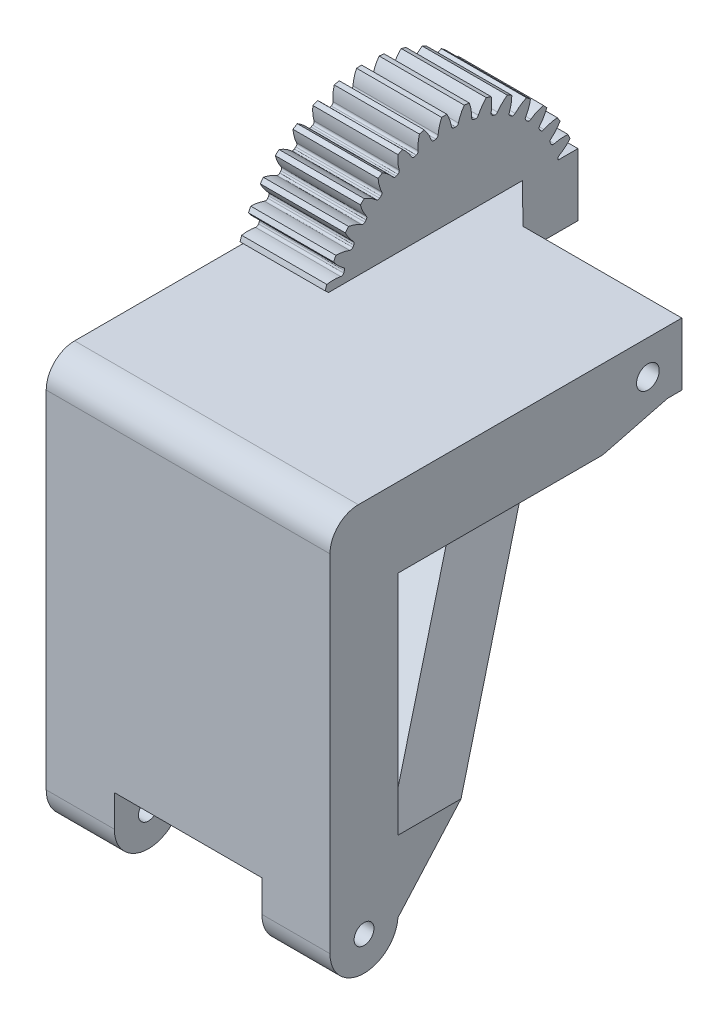
from build123d import *

# Parameters (mm, degrees)
BOSS_EXTRUDE1_START     = 67.5
SKETCH2_R               = 1.749991042
SKETCH2_R_2             = 2.000000542
BOSS_EXTRUDE1_DEPTH     = 50
CUT_EXTRUDE1_DEPTH      = 311.590163462
CUT_EXTRUDE2_START      = 270.018646
CUT_EXTRUDE2_DEPTH      = 53
FILLET1_R               = 5
CUT_EXTRUDE3_DEPTH      = 314.871213788
BOSS_EXTRUDE2_DEPTH     = 15
FILLET1_OF_MIRROR2_R    = 5
CUT_EXTRUDE4_DEPTH      = 145.189488516
CUT_EXTRUDE4_DEPTH_BACK = 145.189488516


with BuildPart() as part:
    # Sketch2 → Boss-Extrude1 (new body)
    with BuildSketch(Plane(origin=(0, 0, 0), x_dir=(0, 0, -1), z_dir=(1, 0, 0)).offset(BOSS_EXTRUDE1_START)):
        with BuildLine():
            Line((-282, -50), (-282, 16.00617549))
            Line((-282, 16.00617549), (-203.32772184, 16.00617549))
            Line((-203.32772184, 16.00617549), (-203.32772184, 4.993638415))
            Line((-203.32772184, 4.993638415), (-222.546576225, 4.993638415))
            Line((-222.546576225, 4.993638415), (-233.933118877, 2.071428354))
            Line((-233.933118877, 2.071428354), (-233.933118877, -9.676461133))
            Line((-233.933118877, -9.676461133), (-270.01864624, -50.472583771))
            ThreePointArc((-270.01864624, -50.472583771), (-276.236478609, -55.995334907), (-282, -50))
        make_face()
        with Locations((-276.000004168, -49.999991628)):
            Circle(SKETCH2_R, mode=Mode.SUBTRACT)
        with Locations((-226.000007629, 10.00000276)):
            Circle(SKETCH2_R_2, mode=Mode.SUBTRACT)
        Polygon((-270.01864624, 2.071428354), (-270.01864624, -35.815644584), (-240.365280151, -2.407390833), (-240.373748779, 1.861065388), align=None, mode=Mode.SUBTRACT)
    boss_extrude1 = extrude(amount=BOSS_EXTRUDE1_DEPTH)

    # Sketch3 → Cut-Extrude1 (cut, through all)
    with BuildSketch(Plane.XY):
        Polygon((79.5, -55.891571045), (79.5, -57.717029151), (105.5, -57.717029151), (105.5, -55.891571045), (105.5, -44.409832001), (79.5, -44.409832001), align=None)
    cut_extrude1 = extrude(amount=CUT_EXTRUDE1_DEPTH, mode=Mode.SUBTRACT)

    # Sketch4 → Cut-Extrude2 (cut)
    with BuildSketch(Plane.XY.offset(CUT_EXTRUDE2_START)):
        with BuildLine():
            Line((105.5, -44.409832001), (94.396057101, -22.201946203))
            ThreePointArc((94.396057101, -22.201946203), (92.5, -21.03011847), (90.603942899, -22.201946203))
            Line((90.603942899, -22.201946203), (79.5, -44.409832001))
            Line((79.5, -44.409832001), (105.5, -44.409832001))
        make_face()
        Polygon((97.5, 2.071428354), (117.5, -37.928571646), (117.5, 2.071428354), align=None)
        Polygon((87.5, 2.071428354), (67.5, 2.071428354), (67.5, -37.928571646), align=None)
    cut_extrude2 = extrude(amount=-CUT_EXTRUDE2_DEPTH, mode=Mode.SUBTRACT)

    # Fillet1
    fillet1_edges = [part.edges().sort_by_distance(p)[0] for p in [
        (92.5, 16.00617549, 282),
    ]]
    fillet(fillet1_edges, radius=FILLET1_R)

    # Sketch5 → Cut-Extrude3 (cut, through all)
    with BuildSketch(Plane(origin=(0, 16.00617549, 0), x_dir=(1, 0, 0), z_dir=(0, 1, 0))):
        Polygon((65.025072437, -220.027445568), (95.5, -220.031402588), (102.5, -213.068008423), (102.5, -196.177042143), (65.025072437, -196.177042143), align=None)
    cut_extrude3 = extrude(amount=-CUT_EXTRUDE3_DEPTH, mode=Mode.SUBTRACT)

    # Sketch7 → Boss-Extrude2 (add)
    with BuildSketch(Plane(origin=(117.5, 0, 0), x_dir=(0, 0, -1), z_dir=(1, 0, 0))):
        with BuildLine():
            Line((-247.249302419, 16.00617549), (-206.818352614, 16.00617549))
            ThreePointArc((-206.818352614, 16.00617549), (-206.832576029, 16.051412996), (-206.846906131, 16.096616819))
            add(Edge.make_bspline(
                [(-206.59811571, 16.641008158), (-206.936572327, 16.462467229), (-206.846906131, 16.096616819)],
                knots=[0, 0, 0, 1, 1, 1], degree=2))
            add(Edge.make_bspline(
                [(-204.7237122, 18.195077672), (-205.525462421, 17.256671604), (-206.59811571, 16.641008158)],
                knots=[0, 0, 0, 1, 1, 1], degree=2))
            ThreePointArc((-204.7237122, 18.195077672), (-204.805887516, 18.405314927), (-204.890140189, 18.61472833))
            ThreePointArc((-204.890140189, 18.61472833), (-204.97646196, 18.823297354), (-205.064844369, 19.031001557))
            add(Edge.make_bspline(
                [(-205.064844369, 19.031001557), (-206.294240862, 19.140516985), (-207.49138078, 18.829900546)],
                knots=[0, 0, 0, 1, 1, 1], degree=2))
            add(Edge.make_bspline(
                [(-207.49138078, 18.829900546), (-207.858117788, 18.720659016), (-208.050024499, 19.044786096)],
                knots=[0, 0, 0, 1, 1, 1], degree=2))
            ThreePointArc((-208.050024499, 19.044786096), (-208.122719215, 19.187633518), (-208.196550701, 19.329896724))
            add(Edge.make_bspline(
                [(-208.046072529, 19.909219539), (-208.348383923, 19.674618673), (-208.196550701, 19.329896724)],
                knots=[0, 0, 0, 1, 1, 1], degree=2))
            add(Edge.make_bspline(
                [(-206.47000676, 21.765165999), (-207.09662409, 20.701793962), (-208.046072529, 19.909219539)],
                knots=[0, 0, 0, 1, 1, 1], degree=2))
            ThreePointArc((-206.47000676, 21.765165999), (-206.587440964, 21.957939684), (-206.706777905, 22.149541303))
            ThreePointArc((-206.706777905, 22.149541303), (-206.828005886, 22.339952077), (-206.951113024, 22.529153342))
            add(Edge.make_bspline(
                [(-206.951113024, 22.529153342), (-208.180849376, 22.423522524), (-209.30586407, 21.909743881)],
                knots=[0, 0, 0, 1, 1, 1], degree=2))
            add(Edge.make_bspline(
                [(-209.30586407, 21.909743881), (-209.648059927, 21.738478762), (-209.893335219, 22.024357373)],
                knots=[0, 0, 0, 1, 1, 1], degree=2))
            ThreePointArc((-209.893335219, 22.024357373), (-209.989730735, 22.152411317), (-210.087144301, 22.279692523))
            add(Edge.make_bspline(
                [(-210.039550582, 22.876344383), (-210.296531173, 22.592811808), (-210.087144301, 22.279692523)],
                knots=[0, 0, 0, 1, 1, 1], degree=2))
            add(Edge.make_bspline(
                [(-208.809710513, 24.977775794), (-209.242155501, 23.821747811), (-210.039550582, 22.876344383)],
                knots=[0, 0, 0, 1, 1, 1], degree=2))
            ThreePointArc((-208.809710513, 24.977775794), (-208.958835427, 25.147228578), (-209.109630644, 25.315196695))
            ThreePointArc((-209.109630644, 25.315196695), (-209.262081383, 25.481663684), (-209.416172702, 25.646613226))
            add(Edge.make_bspline(
                [(-209.416172702, 25.646613226), (-210.608883996, 25.329045702), (-211.627590464, 24.627715759)],
                knots=[0, 0, 0, 1, 1, 1], degree=2))
            add(Edge.make_bspline(
                [(-211.627590464, 24.627715759), (-211.934847721, 24.399630856), (-212.226039031, 24.63857472)],
                knots=[0, 0, 0, 1, 1, 1], degree=2))
            ThreePointArc((-212.226039031, 24.63857472), (-212.343206416, 24.747944332), (-212.4612422, 24.856376161))
            add(Edge.make_bspline(
                [(-212.517979045, 25.452228101), (-212.721820609, 25.128378813), (-212.4612422, 24.856376161)],
                knots=[0, 0, 0, 1, 1, 1], degree=2))
            add(Edge.make_bspline(
                [(-211.671732746, 27.735293534), (-211.89686577, 26.52173493), (-212.517979045, 25.452228101)],
                knots=[0, 0, 0, 1, 1, 1], degree=2))
            ThreePointArc((-211.671732746, 27.735293534), (-211.848017284, 27.87627668), (-212.025688941, 28.01550767))
            ThreePointArc((-212.025688941, 28.01550767), (-212.204730299, 28.152972858), (-212.385123812, 28.288658769))
            add(Edge.make_bspline(
                [(-212.385123812, 28.288658769), (-213.50457012, 27.768803666), (-214.386015482, 26.90123198)],
                knots=[0, 0, 0, 1, 1, 1], degree=2))
            add(Edge.make_bspline(
                [(-214.386015482, 26.90123198), (-214.648998283, 26.623257536), (-214.977257909, 26.808006466)],
                knots=[0, 0, 0, 1, 1, 1], degree=2))
            ThreePointArc((-214.977257909, 26.808006466), (-215.111637092, 26.895368604), (-215.246708637, 26.981656412))
            add(Edge.make_bspline(
                [(-215.406052125, 27.558603772), (-215.550561039, 27.204277766), (-215.246708637, 26.981656412)],
                knots=[0, 0, 0, 1, 1, 1], degree=2))
            add(Edge.make_bspline(
                [(-214.96911236, 29.953933439), (-214.980092868, 28.719717577), (-215.406052125, 27.558603772)],
                knots=[0, 0, 0, 1, 1, 1], degree=2))
            ThreePointArc((-214.96911236, 29.953933439), (-215.167200207, 30.062163245), (-215.366349839, 30.168426644))
            ThreePointArc((-215.366349839, 30.168426644), (-215.566541737, 30.272713221), (-215.767756278, 30.375012754))
            add(Edge.make_bspline(
                [(-215.767756278, 30.375012754), (-216.77992379, 29.668665607), (-217.497325773, 28.661212903)],
                knots=[0, 0, 0, 1, 1, 1], degree=2))
            add(Edge.make_bspline(
                [(-217.497325773, 28.661212903), (-217.708043519, 28.341795031), (-218.063397459, 28.466735524)],
                knots=[0, 0, 0, 1, 1, 1], degree=2))
            ThreePointArc((-218.063397459, 28.466735524), (-218.210905396, 28.529435735), (-218.358908621, 28.590957709))
            add(Edge.make_bspline(
                [(-218.616017182, 29.131470237), (-218.696802615, 28.757433529), (-218.358908621, 28.590957709)],
                knots=[0, 0, 0, 1, 1, 1], degree=2))
            add(Edge.make_bspline(
                [(-218.601660145, 31.566283257), (-218.398154499, 30.348911162), (-218.616017182, 29.131470237)],
                knots=[0, 0, 0, 1, 1, 1], degree=2))
            ThreePointArc((-218.601660145, 31.566283257), (-218.815532501, 31.638471216), (-219.030109049, 31.708538265))
            ThreePointArc((-219.030109049, 31.708538265), (-219.245368756, 31.776477536), (-219.461290523, 31.842282371))
            add(Edge.make_bspline(
                [(-219.461290523, 31.842282371), (-220.335425042, 30.97090518), (-220.866985751, 29.854182399)],
                knots=[0, 0, 0, 1, 1, 1], degree=2))
            add(Edge.make_bspline(
                [(-220.866985751, 29.854182399), (-221.019035889, 29.50302645), (-221.390686893, 29.564362252)],
                knots=[0, 0, 0, 1, 1, 1], degree=2))
            ThreePointArc((-221.390686893, 29.564362252), (-221.54684163, 29.600495421), (-221.703279533, 29.635382248))
            add(Edge.make_bspline(
                [(-222.050341052, 30.123036743), (-222.06494838, 29.74065425), (-221.703279533, 29.635382248)],
                knots=[0, 0, 0, 1, 1, 1], degree=2))
            add(Edge.make_bspline(
                [(-222.459002975, 32.523352556), (-222.047194591, 31.359813463), (-222.050341052, 30.123036743)],
                knots=[0, 0, 0, 1, 1, 1], degree=2))
            ThreePointArc((-222.459002975, 32.523352556), (-222.682161437, 32.557305272), (-222.9056451, 32.589047019))
            ThreePointArc((-222.9056451, 32.589047019), (-223.129432059, 32.618574684), (-223.353500379, 32.645885374))
            add(Edge.make_bspline(
                [(-223.353500379, 32.645885374), (-224.063041769, 31.635954494), (-224.39261, 30.443892693)],
                knots=[0, 0, 0, 1, 1, 1], degree=2))
            add(Edge.make_bspline(
                [(-224.39261, 30.443892693), (-224.481372564, 30.071668363), (-224.858028205, 30.067535817)],
                knots=[0, 0, 0, 1, 1, 1], degree=2))
            ThreePointArc((-224.858028205, 30.067535817), (-225.01808506, 30.076004056), (-225.178204353, 30.083195717))
            add(Edge.make_bspline(
                [(-225.604673542, 30.503175044), (-225.552658929, 30.124065264), (-225.178204353, 30.083195717)],
                knots=[0, 0, 0, 1, 1, 1], degree=2))
            add(Edge.make_bspline(
                [(-226.423937439, 32.796061268), (-225.816338907, 31.721708724), (-225.604673542, 30.503175044)],
                knots=[0, 0, 0, 1, 1, 1], degree=2))
            ThreePointArc((-226.423937439, 32.796061268), (-226.64960145, 32.790747106), (-226.87520179, 32.783199093))
            ThreePointArc((-226.87520179, 32.783199093), (-227.100716348, 32.773417969), (-227.326123018, 32.761404693))
            add(Edge.make_bspline(
                [(-227.326123018, 32.761404693), (-227.849512223, 31.643606363), (-227.967074214, 30.412425737)],
                knots=[0, 0, 0, 1, 1, 1], degree=2))
            add(Edge.make_bspline(
                [(-227.967074214, 30.412425737), (-227.989852198, 30.030442873), (-228.360067984, 29.960967544)],
                knots=[0, 0, 0, 1, 1, 1], degree=2))
            ThreePointArc((-228.360067984, 29.960967544), (-228.51916371, 29.941513551), (-228.67809925, 29.920791531))
            add(Edge.make_bspline(
                [(-229.171018059, 30.26033483), (-229.053961943, 29.896016823), (-228.67809925, 29.920791531)],
                knots=[0, 0, 0, 1, 1, 1], degree=2))
            add(Edge.make_bspline(
                [(-230.375991011, 32.376123278), (-229.591063904, 31.423600941), (-229.171018059, 30.26033483)],
                knots=[0, 0, 0, 1, 1, 1], degree=2))
            ThreePointArc((-230.375991011, 32.376123278), (-230.597303884, 32.331703706), (-230.818166149, 32.285095276))
            ThreePointArc((-230.818166149, 32.285095276), (-231.038556159, 32.236302558), (-231.258452313, 32.185330332))
            add(Edge.make_bspline(
                [(-231.258452313, 32.185330332), (-231.579786416, 30.993628289), (-231.481770104, 29.760737638)],
                knots=[0, 0, 0, 1, 1, 1], degree=2))
            add(Edge.make_bspline(
                [(-231.481770104, 29.760737638), (-231.437871412, 29.380602596), (-231.790398523, 29.247895457)],
                knots=[0, 0, 0, 1, 1, 1], degree=2))
            ThreePointArc((-231.790398523, 29.247895457), (-231.943699078, 29.201110331), (-232.096621689, 29.153104258))
            add(Edge.make_bspline(
                [(-232.641013028, 29.401894679), (-232.462472099, 29.063438062), (-232.096621689, 29.153104258)],
                knots=[0, 0, 0, 1, 1, 1], degree=2))
            add(Edge.make_bspline(
                [(-234.195082542, 31.276298188), (-233.256676474, 30.474547968), (-232.641013028, 29.401894679)],
                knots=[0, 0, 0, 1, 1, 1], degree=2))
            ThreePointArc((-234.195082542, 31.276298188), (-234.405319797, 31.194122873), (-234.6147332, 31.1098702))
            ThreePointArc((-234.6147332, 31.1098702), (-234.823302224, 31.023548429), (-235.031006426, 30.93516602))
            add(Edge.make_bspline(
                [(-235.031006426, 30.93516602), (-235.140521855, 29.705769527), (-234.829905416, 28.508629609)],
                knots=[0, 0, 0, 1, 1, 1], degree=2))
            add(Edge.make_bspline(
                [(-234.829905416, 28.508629609), (-234.720663886, 28.141892601), (-235.044790966, 27.94998589)],
                knots=[0, 0, 0, 1, 1, 1], degree=2))
            ThreePointArc((-235.044790966, 27.94998589), (-235.187638388, 27.877291174), (-235.329901594, 27.803459688))
            add(Edge.make_bspline(
                [(-235.909224409, 27.95393786), (-235.674623543, 27.651626466), (-235.329901594, 27.803459688)],
                knots=[0, 0, 0, 1, 1, 1], degree=2))
            add(Edge.make_bspline(
                [(-237.765170868, 29.530003629), (-236.701798832, 28.903386299), (-235.909224409, 27.95393786)],
                knots=[0, 0, 0, 1, 1, 1], degree=2))
            ThreePointArc((-237.765170868, 29.530003629), (-237.957944553, 29.412569424), (-238.149546173, 29.293232484))
            ThreePointArc((-238.149546173, 29.293232484), (-238.339956947, 29.172004503), (-238.529158211, 29.048897365))
            add(Edge.make_bspline(
                [(-238.529158211, 29.048897365), (-238.423527394, 27.819161013), (-237.909748751, 26.694146319)],
                knots=[0, 0, 0, 1, 1, 1], degree=2))
            add(Edge.make_bspline(
                [(-237.909748751, 26.694146319), (-237.738483632, 26.351950462), (-238.024362243, 26.10667517)],
                knots=[0, 0, 0, 1, 1, 1], degree=2))
            ThreePointArc((-238.024362243, 26.10667517), (-238.152416187, 26.010279654), (-238.279697393, 25.912866088))
            add(Edge.make_bspline(
                [(-238.876349252, 25.960459807), (-238.592816678, 25.703479216), (-238.279697393, 25.912866088)],
                knots=[0, 0, 0, 1, 1, 1], degree=2))
            add(Edge.make_bspline(
                [(-240.977780663, 27.190299876), (-239.82175268, 26.757854888), (-238.876349252, 25.960459807)],
                knots=[0, 0, 0, 1, 1, 1], degree=2))
            ThreePointArc((-240.977780663, 27.190299876), (-241.147233447, 27.041174962), (-241.315201565, 26.890379745))
            ThreePointArc((-241.315201565, 26.890379745), (-241.481668554, 26.737929006), (-241.646618096, 26.583837687))
            add(Edge.make_bspline(
                [(-241.646618096, 26.583837687), (-241.329050571, 25.391126392), (-240.627720629, 24.372419924)],
                knots=[0, 0, 0, 1, 1, 1], degree=2))
            add(Edge.make_bspline(
                [(-240.627720629, 24.372419924), (-240.399635725, 24.065162668), (-240.63857959, 23.773971358)],
                knots=[0, 0, 0, 1, 1, 1], degree=2))
            ThreePointArc((-240.63857959, 23.773971358), (-240.747949202, 23.656803973), (-240.856381031, 23.538768189))
            add(Edge.make_bspline(
                [(-241.452232971, 23.482031344), (-241.128383682, 23.27818978), (-240.856381031, 23.538768189)],
                knots=[0, 0, 0, 1, 1, 1], degree=2))
            add(Edge.make_bspline(
                [(-243.735298404, 24.328277643), (-242.521739799, 24.103144619), (-241.452232971, 23.482031344)],
                knots=[0, 0, 0, 1, 1, 1], degree=2))
            ThreePointArc((-243.735298404, 24.328277643), (-243.87628155, 24.151993104), (-244.01551254, 23.974321448))
            ThreePointArc((-244.01551254, 23.974321448), (-244.152977728, 23.795280089), (-244.288663639, 23.614886577))
            add(Edge.make_bspline(
                [(-244.288663639, 23.614886577), (-243.768808536, 22.495440269), (-242.90123685, 21.613994907)],
                knots=[0, 0, 0, 1, 1, 1], degree=2))
            add(Edge.make_bspline(
                [(-242.90123685, 21.613994907), (-242.623262405, 21.351012106), (-242.808011336, 21.02275248)],
                knots=[0, 0, 0, 1, 1, 1], degree=2))
            ThreePointArc((-242.808011336, 21.02275248), (-242.895373474, 20.888373297), (-242.981661282, 20.753301752))
            add(Edge.make_bspline(
                [(-243.558608642, 20.593958264), (-243.204282636, 20.44944935), (-242.981661282, 20.753301752)],
                knots=[0, 0, 0, 1, 1, 1], degree=2))
            add(Edge.make_bspline(
                [(-245.953938309, 21.030898029), (-244.719722447, 21.019917521), (-243.558608642, 20.593958264)],
                knots=[0, 0, 0, 1, 1, 1], degree=2))
            ThreePointArc((-245.953938309, 21.030898029), (-246.062168115, 20.832810182), (-246.168431514, 20.63366055))
            ThreePointArc((-246.168431514, 20.63366055), (-246.272718091, 20.433468652), (-246.375017624, 20.232254111))
            add(Edge.make_bspline(
                [(-246.375017624, 20.232254111), (-245.668670477, 19.220086599), (-244.661217773, 18.502684616)],
                knots=[0, 0, 0, 1, 1, 1], degree=2))
            add(Edge.make_bspline(
                [(-244.661217773, 18.502684616), (-244.341799901, 18.29196687), (-244.466740394, 17.93661293)],
                knots=[0, 0, 0, 1, 1, 1], degree=2))
            ThreePointArc((-244.466740394, 17.93661293), (-244.529440605, 17.789104993), (-244.590962579, 17.641101768))
            add(Edge.make_bspline(
                [(-245.131475107, 17.383993207), (-244.757438399, 17.303207774), (-244.590962579, 17.641101768)],
                knots=[0, 0, 0, 1, 1, 1], degree=2))
            add(Edge.make_bspline(
                [(-247.566288127, 17.398350244), (-246.348916032, 17.60185589), (-245.131475107, 17.383993207)],
                knots=[0, 0, 0, 1, 1, 1], degree=2))
            ThreePointArc((-247.566288127, 17.398350244), (-247.638476086, 17.184477888), (-247.708543134, 16.96990134))
            ThreePointArc((-247.708543134, 16.96990134), (-247.776482406, 16.754641633), (-247.84228724, 16.538719866))
            add(Edge.make_bspline(
                [(-247.84228724, 16.538719866), (-247.558780453, 16.254315972), (-247.249302419, 16.00617549)],
                knots=[0, 0, 0, 0.325354841, 0.325354841, 0.325354841], degree=2))
        make_face()
    boss_extrude2 = extrude(amount=-BOSS_EXTRUDE2_DEPTH)

    # Mirror2: Boss-Extrude1, Cut-Extrude1, Cut-Extrude2, Cut-Extrude3, Boss-Extrude2 across plane
    add(boss_extrude1.mirror(Plane(origin=(67.5, -49.999999767, 276.000002986), x_dir=(0, 0, 1), z_dir=(1, 0, 0))))
    add(cut_extrude1.mirror(Plane(origin=(67.5, -49.999999767, 276.000002986), x_dir=(0, 0, 1), z_dir=(1, 0, 0))), mode=Mode.SUBTRACT)
    add(cut_extrude2.mirror(Plane(origin=(67.5, -49.999999767, 276.000002986), x_dir=(0, 0, 1), z_dir=(1, 0, 0))), mode=Mode.SUBTRACT)
    add(cut_extrude3.mirror(Plane(origin=(67.5, -49.999999767, 276.000002986), x_dir=(0, 0, 1), z_dir=(1, 0, 0))), mode=Mode.SUBTRACT)
    add(boss_extrude2.mirror(Plane(origin=(67.5, -49.999999767, 276.000002986), x_dir=(0, 0, 1), z_dir=(1, 0, 0))))

    # Fillet1 of Mirror2
    fillet1_of_mirror2_edges = [part.edges().sort_by_distance(p)[0] for p in [
        (42.5, 16.00617549, 282),
    ]]
    fillet(fillet1_of_mirror2_edges, radius=FILLET1_OF_MIRROR2_R)

    # Sketch8 → Cut-Extrude4 (cut, two sides: drawn at the far end of the back side and taken through both)
    with BuildSketch(Plane(origin=(-0.028568385, 0, 220.018998673), x_dir=(-0.9999999915701275, 0, -0.00012984508030795087), z_dir=(0.00012984508030795087, 0, -0.9999999915701275)).offset(-CUT_EXTRUDE4_DEPTH_BACK)):
        Polygon((-67.528568954, 16.00617549), (-67.528568954, 48.940984436), (-128.157967853, 48.940984436), (-128.157967853, -63.460137841), (-67.528568954, -63.460137841), align=None)
    extrude(amount=CUT_EXTRUDE4_DEPTH + CUT_EXTRUDE4_DEPTH_BACK, mode=Mode.SUBTRACT)


solid = part.part
